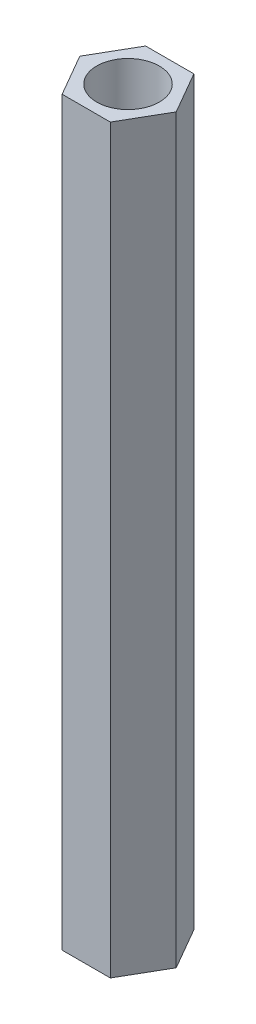
from build123d import *

# Parameters (mm, degrees)
SKETCH_1_R      = 3
EXTRUDE_1_DEPTH = 71


with BuildPart() as part:
    # 草图1 → 凸台-拉伸1 (new body)
    with BuildSketch(Plane(origin=(0, 0, 0), x_dir=(1, 0, 0), z_dir=(0, 1, 0))):
        Polygon((4.618802154, 0), (2.309401077, 4), (-2.309401077, 4), (-4.618802154, 0), (-2.309401077, -4), (2.309401077, -4), align=None)
        with Locations(Location((0, 0, 0), (0, 0, 270))):
            Circle(SKETCH_1_R, mode=Mode.SUBTRACT)
    extrude(amount=EXTRUDE_1_DEPTH)


solid = part.part
